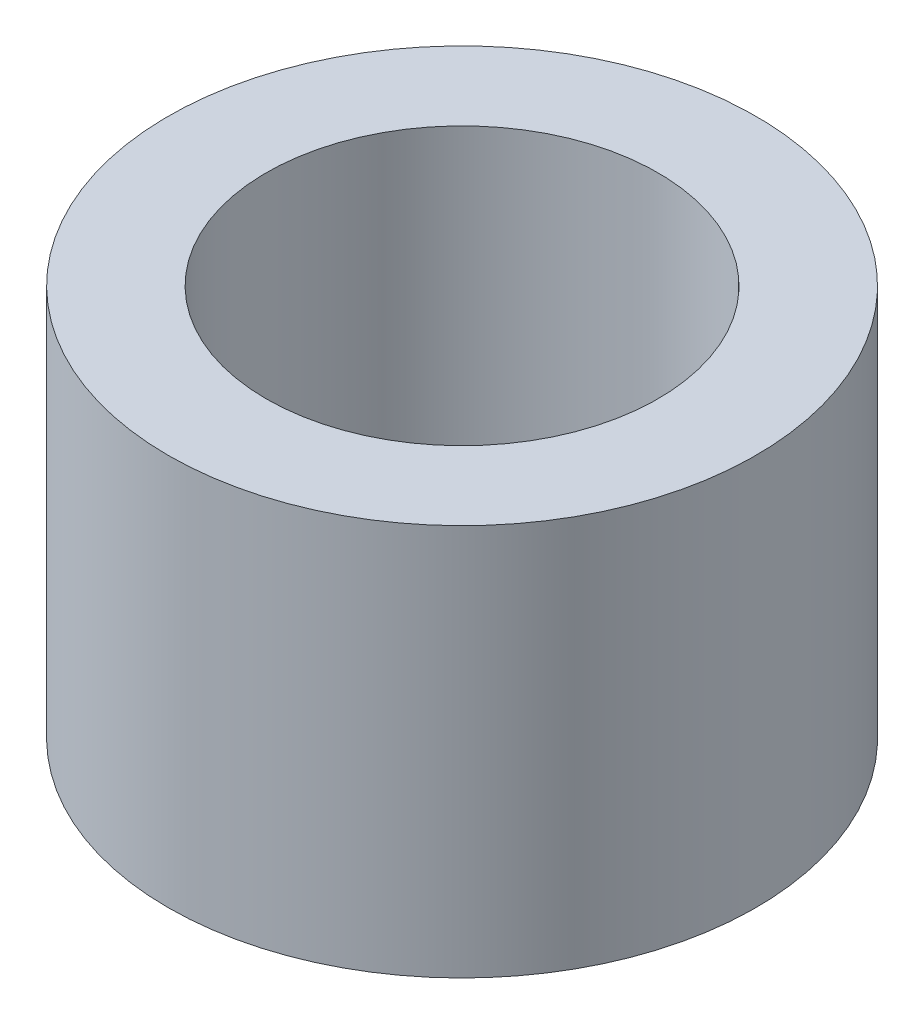
from build123d import *

# Parameters (mm, degrees)
ESBO_O2_R                = 1.5
ESBO_O2_R_2              = 1
RESSALTO_EXTRUS_O1_DEPTH = 2


with BuildPart() as part:
    # Esboço2 → Ressalto-extrusão1 (new body)
    with BuildSketch(Plane(origin=(0, 0, 0), x_dir=(1, 0, 0), z_dir=(0, 1, 0))):
        with Locations(Location((0, 0, 0), (0, 0, 270))):
            Circle(ESBO_O2_R)
        with Locations(Location((0, 0, 0), (0, 0, 270))):
            Circle(ESBO_O2_R_2, mode=Mode.SUBTRACT)
    extrude(amount=RESSALTO_EXTRUS_O1_DEPTH)


solid = part.part
